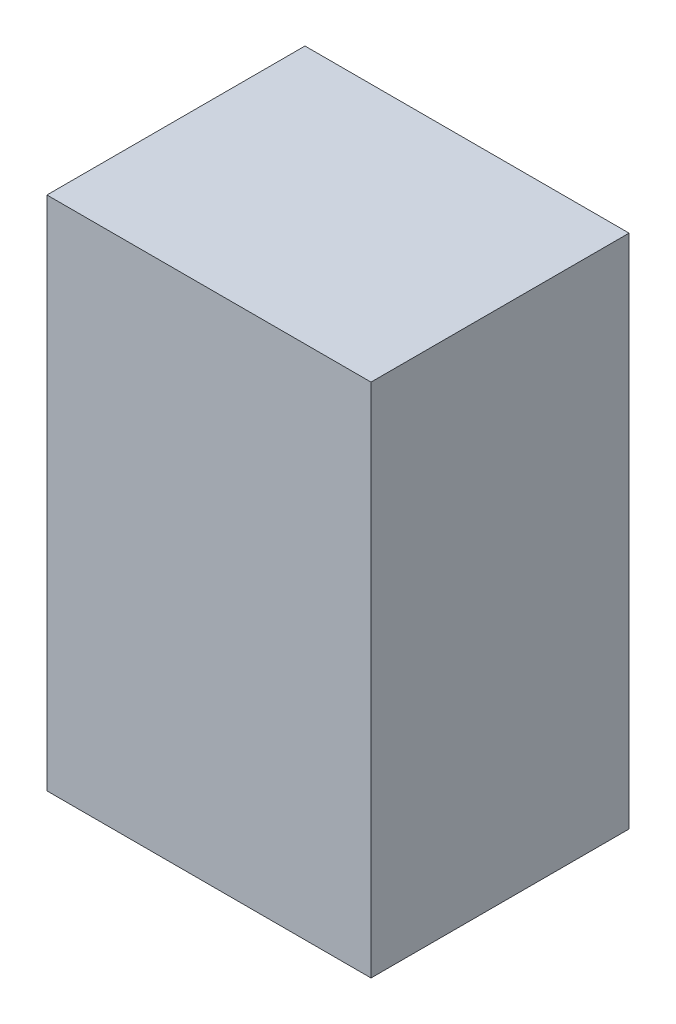
from build123d import *

# Parameters (mm, degrees)
SKETCH_3_W      = 62.8
SKETCH_3_H      = 50
EXTRUDE_1_DEPTH = 100


with BuildPart() as part:
    # 草图3 → 凸台-拉伸1 (new body)
    with BuildSketch(Plane(origin=(0, 0, 0), x_dir=(1, 0, 0), z_dir=(0, 1, 0))):
        with Locations((-23.878768884, -9.010273463)):
            Rectangle(SKETCH_3_W, SKETCH_3_H)
    extrude(amount=EXTRUDE_1_DEPTH)


solid = part.part
